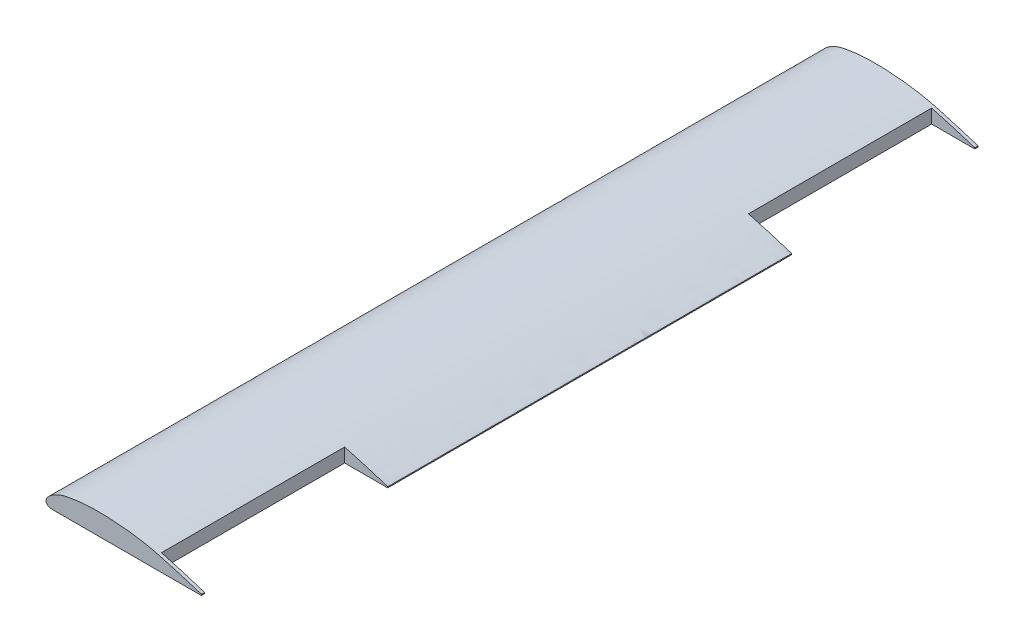
from build123d import *

# Parameters (mm, degrees)
BOSS_EXTRUDE1_DEPTH = 1524
CUT_EXTRUDE1_DEPTH  = 1235.692187154


with BuildPart() as part:
    # Sketch1 → Boss-Extrude1 (new body)
    with BuildSketch(Plane.XY):
        with BuildLine():
            Line((306.2918866, 0.06125608), (306.2918866, 1.929193729))
            add(Edge.make_bspline(
                [(306.2918866, 1.929193729), (306.564414308, 2.601103907), (288.666182524, 7.516021399), (272.089697541, 13.067400941), (244.845732816, 20.950585532), (215.082653309, 29.449979818), (184.344520243, 35.685913329), (153.784254075, 39.410202948), (123.257723072, 41.726971171), (92.718862182, 42.050877324), (67.258109319, 40.202363559), (46.989693296, 36.996561506), (34.119297907, 34.250240848), (24.159756468, 30.02306537), (16.367225285, 26.232042553), (10.013142841, 21.690495841), (4.07818139, 16.173428758), (-0.365057057, 8.549874417), (4.487134511, 2.030134218), (10.433293339, 0.369099766), (15.303428835, 0.097799584), (18.818361359, 0.060504865), (19.780492057, 0.06125608)],
                knots=[0, 0, 0, 0, 0.025556044, 0.050960447, 0.101552747, 0.151805438, 0.201252492, 0.250083002, 0.298629141, 0.347026117, 0.395536064, 0.420002519, 0.444885368, 0.457915187, 0.471441031, 0.48620838, 0.494593531, 0.510948222, 0.521394631, 0.527823606, 0.539981828, 0.544566103, 0.544566103, 0.544566103, 0.544566103], degree=3))
            Line((19.780492057, 0.06125608), (306.2918866, 0.06125608))
        make_face()
    extrude(amount=BOSS_EXTRUDE1_DEPTH)

    # 3DSketch1 → Cut-Extrude1 (cut, symmetric)
    with BuildSketch(Plane(origin=(427.156596146, 0, 365.76), x_dir=(-0.49622554751963377, 0, -0.8681936454437107), z_dir=(0, -1, 0))):
        Polygon((0, 0), (101.936987019, -178.348424034), (413.974465128, 0), (312.037478109, 178.348424034), align=None)
    cut_extrude1 = extrude(amount=CUT_EXTRUDE1_DEPTH, both=True, mode=Mode.SUBTRACT)

    # Mirror1: Cut-Extrude1 across plane
    add(cut_extrude1.mirror(Plane(origin=(0, 0, 762), x_dir=(1, 0, 0), z_dir=(0, 0, -1))), mode=Mode.SUBTRACT)


solid = part.part
